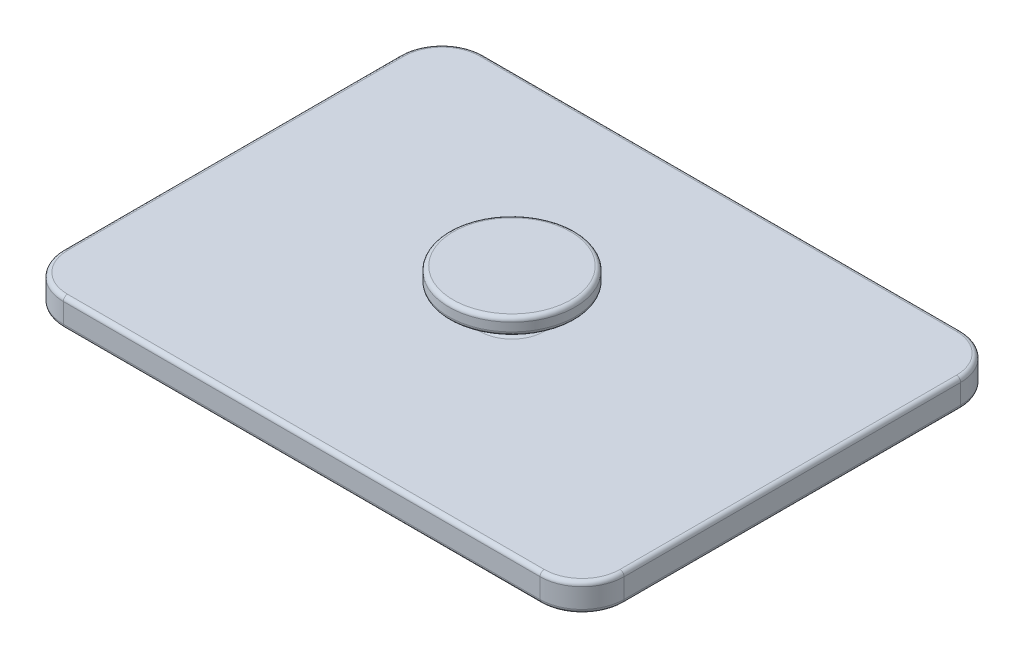
from build123d import *

# Parameters (mm, degrees)
SKETCH1_R           = 4.5
BOSS_EXTRUDE1_DEPTH = 1.2
SKETCH2_R           = 2
BOSS_EXTRUDE2_DEPTH = 1.7
SKETCH4_W           = 40
SKETCH4_H           = 30
BOSS_EXTRUDE3_DEPTH = 2
FILLET1_R           = 3
FILLET2_R           = 0.3
FILLET3_R           = 0.3
FILLET4_R           = 0.3
FILLET5_R           = 0.3
FILLET6_R           = 0.3
FILLET7_R           = 0.3


with BuildPart() as part:
    # Sketch1 → Boss-Extrude1 (new body)
    with BuildSketch(Plane.XZ.offset(20)):
        with Locations(Location((0, 0, 0), (0, 0, 270))):
            Circle(SKETCH1_R)
    extrude(amount=BOSS_EXTRUDE1_DEPTH)

    # Sketch2 → Boss-Extrude2 (add)
    with BuildSketch(Plane.XZ.offset(21.2)):
        with Locations(Location((0, 0, 0), (0, 0, 270))):
            Circle(SKETCH2_R)
    extrude(amount=BOSS_EXTRUDE2_DEPTH)

    # Sketch4 → Boss-Extrude3 (add)
    with BuildSketch(Plane.XZ.offset(22.9)):
        Rectangle(SKETCH4_W, SKETCH4_H)
    extrude(amount=BOSS_EXTRUDE3_DEPTH)

    # Fillet1
    fillet1_edges = [part.edges().sort_by_distance(p)[0] for p in [
        (-20, -23.9, -15),
        (20, -23.9, -15),
        (20, -23.9, 15),
        (-20, -23.9, 15),
    ]]
    fillet(fillet1_edges, radius=FILLET1_R)

    # Fillet2
    fillet2_edges = [part.edges().sort_by_distance(p)[0] for p in [
        (20, -24.9, 0),
        (0, -24.9, -15),
        (-20, -24.9, 0),
        (0, -24.9, 15),
        (-19.121320344, -24.9, -14.121320344),
        (-19.121320344, -24.9, 14.121320344),
        (19.121320344, -24.9, 14.121320344),
        (19.121320344, -24.9, -14.121320344),
    ]]
    fillet(fillet2_edges, radius=FILLET2_R)

    # Fillet3
    fillet3_edges = [part.edges().sort_by_distance(p)[0] for p in [
        (20, -22.9, 0),
        (-20, -22.9, 0),
        (0, -22.9, 15),
        (0, -22.9, -15),
        (-19.121320344, -22.9, -14.121320344),
        (-19.121320344, -22.9, 14.121320344),
        (19.121320344, -22.9, 14.121320344),
        (19.121320344, -22.9, -14.121320344),
    ]]
    fillet(fillet3_edges, radius=FILLET3_R)

    # Fillet4
    fillet4_edges = [part.edges().sort_by_distance(p)[0] for p in [
        (0, -21.2, 4.5),
    ]]
    fillet(fillet4_edges, radius=FILLET4_R)

    # Fillet5
    fillet5_edges = [part.edges().sort_by_distance(p)[0] for p in [
        (0, -20, 4.5),
    ]]
    fillet(fillet5_edges, radius=FILLET5_R)

    # Fillet6
    fillet6_edges = [part.edges().sort_by_distance(p)[0] for p in [
        (0, -22.9, 2),
    ]]
    fillet(fillet6_edges, radius=FILLET6_R)

    # Fillet7
    fillet7_edges = [part.edges().sort_by_distance(p)[0] for p in [
        (0, -21.2, 2),
    ]]
    fillet(fillet7_edges, radius=FILLET7_R)


solid = part.part
